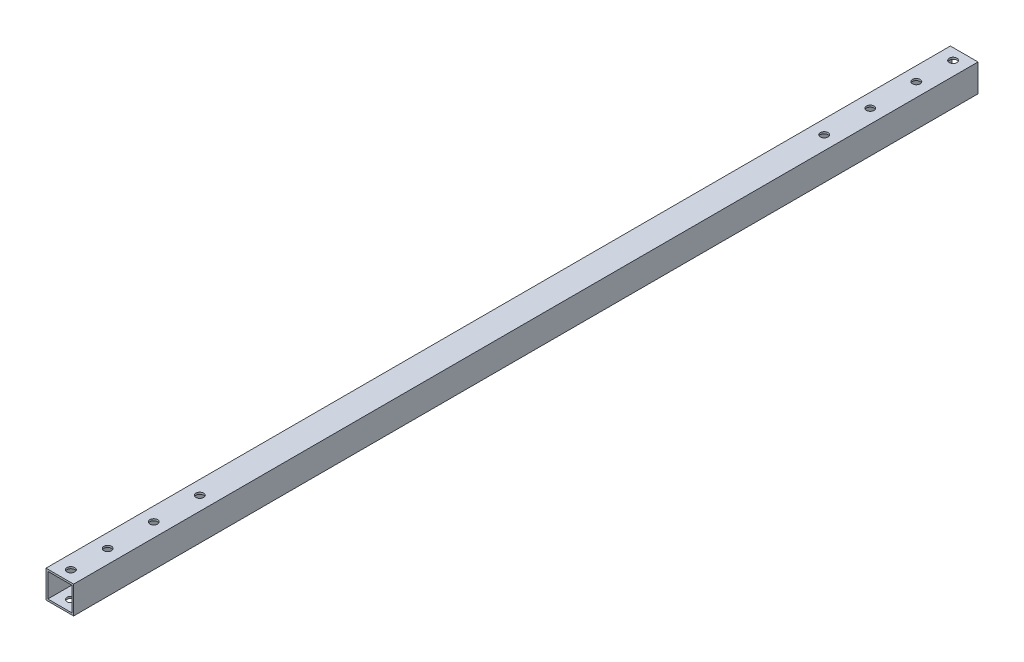
from build123d import *

# Parameters (mm, degrees)
SKETCH_1_W          = 15
SKETCH_1_H          = 15
SKETCH_1_W_2        = 13
SKETCH_1_H_2        = 13
EXTRUDE_1_DEPTH     = 491
SKETCH_2_R          = 2.1
CUT_EXTRUDE_1_DEPTH = 500


with BuildPart() as part:
    # 草图1 → 凸台-拉伸1 (new body)
    with BuildSketch(Plane.XY):
        Rectangle(SKETCH_1_W, SKETCH_1_H)
        Rectangle(SKETCH_1_W_2, SKETCH_1_H_2, mode=Mode.SUBTRACT)
    extrude(amount=EXTRUDE_1_DEPTH)

    # 草图2 → 切除-拉伸1 (cut)
    with BuildSketch(Plane(origin=(0, 7.5, 0), x_dir=(1, 0, 0), z_dir=(0, 1, 0))):
        with Locations(Location((0, -6, 0), (0, 0, 180))):
            Circle(SKETCH_2_R)
        with Locations(Location((0, -26, 0), (0, 0, 180))):
            Circle(SKETCH_2_R)
        with Locations(Location((0, -51, 0), (0, 0, 180))):
            Circle(SKETCH_2_R)
        with Locations(Location((0, -76, 0), (0, 0, 180))):
            Circle(SKETCH_2_R)
        with Locations(Location((0, -415, 0), (0, 0, 180))):
            Circle(SKETCH_2_R)
        with Locations(Location((0, -440, 0), (0, 0, 180))):
            Circle(SKETCH_2_R)
        with Locations(Location((0, -465, 0), (0, 0, 180))):
            Circle(SKETCH_2_R)
        with Locations(Location((0, -485, 0), (0, 0, 180))):
            Circle(SKETCH_2_R)
    extrude(amount=-CUT_EXTRUDE_1_DEPTH, mode=Mode.SUBTRACT)


solid = part.part
